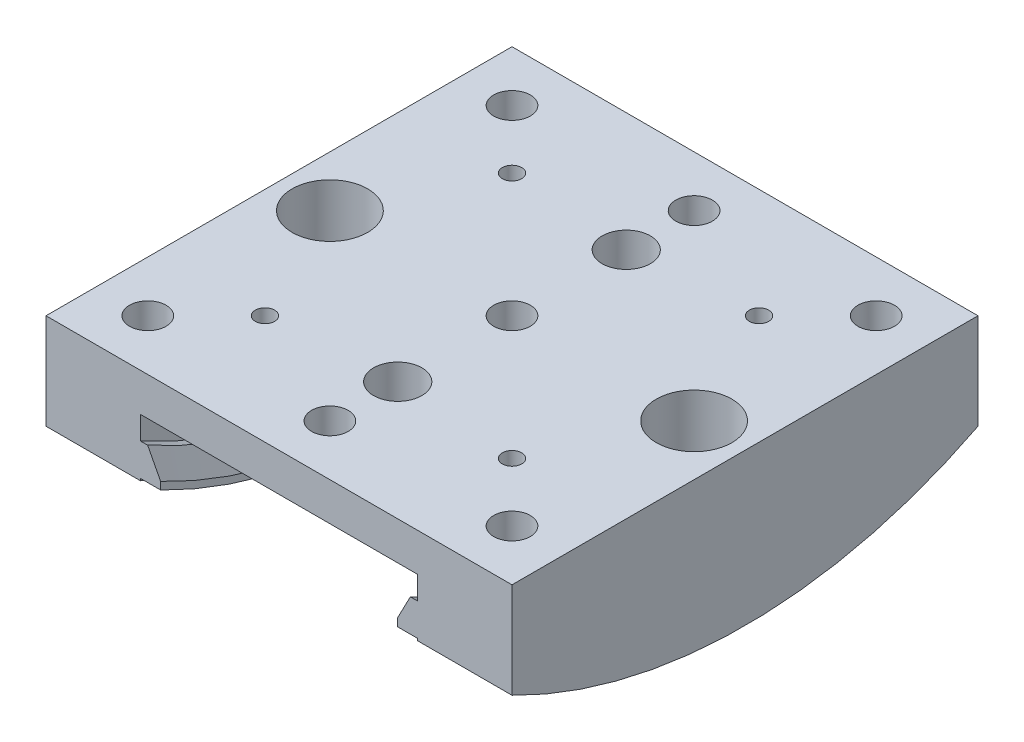
from build123d import *

# Parameters (mm, degrees)
SKIZZE1_W                            = 65
SKIZZE1_H                            = 30
AUFSATZ_LINEAR_AUSTRAGEN1_DEPTH      = 65
SCHNITT_LINEAR_AUSTRAGEN2_DEPTH      = 94.139680207
SCHNITT_LINEAR_AUSTRAGEN2_DEPTH_BACK = 94.139680207
SCHNITT_LINEAR_AUSTRAGEN4_REACH      = 77.701
SKIZZE10_R                           = 5.2705
SKIZZE10_R_2                         = 3.3655
SKIZZE10_R_3                         = 2.5525
SKIZZE10_R_4                         = 1.3525


with BuildPart() as part:
    # Skizze1 → Aufsatz-Linear austragen1 (new body)
    with BuildSketch(Plane.XY):
        Rectangle(SKIZZE1_W, SKIZZE1_H)
    extrude(amount=AUFSATZ_LINEAR_AUSTRAGEN1_DEPTH)

    # Schnitt-Austragung2: sweep along a path in Skizze8
    with BuildLine(Plane(origin=(0, 0, 0), x_dir=(0, 0, -1), z_dir=(1, 0, 0))) as schnitt_austragung2_path:
        CenterArc((-32.5, 65), 71.1987, 0, 360)
    # Skizze7 → Schnitt-Austragung2 (sweep, cut)
    with BuildSketch(Plane.XY.offset(65)):
        Polygon((19.32985, 9.6751), (-19.32985, 9.6751), (-19.32985, 6.4564), (-18.32085, 6.4564), (-16.50885, 2.9847), (-16.50885, 1.9417), (-19.32985, 1.9417), (-19.32985, 1.6517), (19.32985, 1.6517), (19.32985, 1.9417), (16.50885, 1.9417), (16.50885, 2.9847), (18.32085, 6.4564), (19.32985, 6.4564), align=None)
    sweep(path=schnitt_austragung2_path.line, mode=Mode.SUBTRACT)

    # Skizze9 → Schnitt-Linear austragen2 (cut, two sides: drawn at the far end of the back side and taken through both)
    with BuildSketch(Plane.ZY.offset(32.5).offset(-SCHNITT_LINEAR_AUSTRAGEN2_DEPTH_BACK)):
        with BuildLine():
            ThreePointArc((65, 1.651717611), (32.5, -6.1987), (0, 1.651717611))
            Line((0, 1.651717611), (0, -15))
            Line((0, -15), (65, -15))
            Line((65, -15), (65, 1.651717611))
        make_face()
    extrude(amount=SCHNITT_LINEAR_AUSTRAGEN2_DEPTH + SCHNITT_LINEAR_AUSTRAGEN2_DEPTH_BACK, mode=Mode.SUBTRACT)

    # Skizze10 → Schnitt-Linear austragen4 (cut, up to next)
    with BuildSketch(Plane(origin=(0, 15, 0), x_dir=(1, 0, 0), z_dir=(0, 1, 0)), mode=Mode.PRIVATE) as schnitt_linear_austragen4_sk1:
        with Locations(Location((-25.399, -32.5, 0), (0, 0, 270))):
            Circle(SKIZZE10_R)
    schnitt_linear_austragen4_tool1 = extrude(schnitt_linear_austragen4_sk1.sketch, amount=-SCHNITT_LINEAR_AUSTRAGEN4_REACH, mode=Mode.PRIVATE) & part.part
    # Skizze10 → Schnitt-Linear austragen4 (cut, up to next)
    with BuildSketch(Plane(origin=(0, 15, 0), x_dir=(1, 0, 0), z_dir=(0, 1, 0)), mode=Mode.PRIVATE) as schnitt_linear_austragen4_sk2:
        with Locations(Location((25.399, -32.5, 0), (0, 0, 270))):
            Circle(SKIZZE10_R)
    schnitt_linear_austragen4_tool2 = extrude(schnitt_linear_austragen4_sk2.sketch, amount=-SCHNITT_LINEAR_AUSTRAGEN4_REACH, mode=Mode.PRIVATE) & part.part
    # Skizze10 → Schnitt-Linear austragen4 (cut, up to next)
    with BuildSketch(Plane(origin=(0, 15, 0), x_dir=(1, 0, 0), z_dir=(0, 1, 0)), mode=Mode.PRIVATE) as schnitt_linear_austragen4_sk3:
        with Locations(Location((0, -16.562, 0), (0, 0, 270))):
            Circle(SKIZZE10_R_2)
    schnitt_linear_austragen4_tool3 = extrude(schnitt_linear_austragen4_sk3.sketch, amount=-SCHNITT_LINEAR_AUSTRAGEN4_REACH, mode=Mode.PRIVATE) & part.part
    # Skizze10 → Schnitt-Linear austragen4 (cut, up to next)
    with BuildSketch(Plane(origin=(0, 15, 0), x_dir=(1, 0, 0), z_dir=(0, 1, 0)), mode=Mode.PRIVATE) as schnitt_linear_austragen4_sk4:
        with Locations(Location((0, -48.438, 0), (0, 0, 270))):
            Circle(SKIZZE10_R_2)
    schnitt_linear_austragen4_tool4 = extrude(schnitt_linear_austragen4_sk4.sketch, amount=-SCHNITT_LINEAR_AUSTRAGEN4_REACH, mode=Mode.PRIVATE) & part.part
    # Skizze10 → Schnitt-Linear austragen4 (cut, up to next)
    with BuildSketch(Plane(origin=(0, 15, 0), x_dir=(1, 0, 0), z_dir=(0, 1, 0)), mode=Mode.PRIVATE) as schnitt_linear_austragen4_sk5:
        with Locations(Location((-25.4, -7.1, 0), (0, 0, 270))):
            Circle(SKIZZE10_R_3)
    schnitt_linear_austragen4_tool5 = extrude(schnitt_linear_austragen4_sk5.sketch, amount=-SCHNITT_LINEAR_AUSTRAGEN4_REACH, mode=Mode.PRIVATE) & part.part
    # Skizze10 → Schnitt-Linear austragen4 (cut, up to next)
    with BuildSketch(Plane(origin=(0, 15, 0), x_dir=(1, 0, 0), z_dir=(0, 1, 0)), mode=Mode.PRIVATE) as schnitt_linear_austragen4_sk6:
        with Locations(Location((25.4, -7.1, 0), (0, 0, 270))):
            Circle(SKIZZE10_R_3)
    schnitt_linear_austragen4_tool6 = extrude(schnitt_linear_austragen4_sk6.sketch, amount=-SCHNITT_LINEAR_AUSTRAGEN4_REACH, mode=Mode.PRIVATE) & part.part
    # Skizze10 → Schnitt-Linear austragen4 (cut, up to next)
    with BuildSketch(Plane(origin=(0, 15, 0), x_dir=(1, 0, 0), z_dir=(0, 1, 0)), mode=Mode.PRIVATE) as schnitt_linear_austragen4_sk7:
        with Locations(Location((0, -7.1, 0), (0, 0, 270))):
            Circle(SKIZZE10_R_3)
    schnitt_linear_austragen4_tool7 = extrude(schnitt_linear_austragen4_sk7.sketch, amount=-SCHNITT_LINEAR_AUSTRAGEN4_REACH, mode=Mode.PRIVATE) & part.part
    # Skizze10 → Schnitt-Linear austragen4 (cut, up to next)
    with BuildSketch(Plane(origin=(0, 15, 0), x_dir=(1, 0, 0), z_dir=(0, 1, 0)), mode=Mode.PRIVATE) as schnitt_linear_austragen4_sk8:
        with Locations(Location((25.4, -57.9, 0), (0, 0, 270))):
            Circle(SKIZZE10_R_3)
    schnitt_linear_austragen4_tool8 = extrude(schnitt_linear_austragen4_sk8.sketch, amount=-SCHNITT_LINEAR_AUSTRAGEN4_REACH, mode=Mode.PRIVATE) & part.part
    # Skizze10 → Schnitt-Linear austragen4 (cut, up to next)
    with BuildSketch(Plane(origin=(0, 15, 0), x_dir=(1, 0, 0), z_dir=(0, 1, 0)), mode=Mode.PRIVATE) as schnitt_linear_austragen4_sk9:
        with Locations(Location((0, -57.9, 0), (0, 0, 270))):
            Circle(SKIZZE10_R_3)
    schnitt_linear_austragen4_tool9 = extrude(schnitt_linear_austragen4_sk9.sketch, amount=-SCHNITT_LINEAR_AUSTRAGEN4_REACH, mode=Mode.PRIVATE) & part.part
    # Skizze10 → Schnitt-Linear austragen4 (cut, up to next)
    with BuildSketch(Plane(origin=(0, 15, 0), x_dir=(1, 0, 0), z_dir=(0, 1, 0)), mode=Mode.PRIVATE) as schnitt_linear_austragen4_sk10:
        with Locations(Location((-25.4, -57.9, 0), (0, 0, 270))):
            Circle(SKIZZE10_R_3)
    schnitt_linear_austragen4_tool10 = extrude(schnitt_linear_austragen4_sk10.sketch, amount=-SCHNITT_LINEAR_AUSTRAGEN4_REACH, mode=Mode.PRIVATE) & part.part
    # Skizze10 → Schnitt-Linear austragen4 (cut, up to next)
    with BuildSketch(Plane(origin=(0, 15, 0), x_dir=(1, 0, 0), z_dir=(0, 1, 0)), mode=Mode.PRIVATE) as schnitt_linear_austragen4_sk11:
        with Locations(Location((-17.227, -15.273, 0), (0, 0, 270))):
            Circle(SKIZZE10_R_4)
    schnitt_linear_austragen4_tool11 = extrude(schnitt_linear_austragen4_sk11.sketch, amount=-SCHNITT_LINEAR_AUSTRAGEN4_REACH, mode=Mode.PRIVATE) & part.part
    # Skizze10 → Schnitt-Linear austragen4 (cut, up to next)
    with BuildSketch(Plane(origin=(0, 15, 0), x_dir=(1, 0, 0), z_dir=(0, 1, 0)), mode=Mode.PRIVATE) as schnitt_linear_austragen4_sk12:
        with Locations(Location((17.227, -15.273, 0), (0, 0, 270))):
            Circle(SKIZZE10_R_4)
    schnitt_linear_austragen4_tool12 = extrude(schnitt_linear_austragen4_sk12.sketch, amount=-SCHNITT_LINEAR_AUSTRAGEN4_REACH, mode=Mode.PRIVATE) & part.part
    # Skizze10 → Schnitt-Linear austragen4 (cut, up to next)
    with BuildSketch(Plane(origin=(0, 15, 0), x_dir=(1, 0, 0), z_dir=(0, 1, 0)), mode=Mode.PRIVATE) as schnitt_linear_austragen4_sk13:
        with Locations(Location((17.227, -49.727, 0), (0, 0, 270))):
            Circle(SKIZZE10_R_4)
    schnitt_linear_austragen4_tool13 = extrude(schnitt_linear_austragen4_sk13.sketch, amount=-SCHNITT_LINEAR_AUSTRAGEN4_REACH, mode=Mode.PRIVATE) & part.part
    # Skizze10 → Schnitt-Linear austragen4 (cut, up to next)
    with BuildSketch(Plane(origin=(0, 15, 0), x_dir=(1, 0, 0), z_dir=(0, 1, 0)), mode=Mode.PRIVATE) as schnitt_linear_austragen4_sk14:
        with Locations(Location((-17.227, -49.727, 0), (0, 0, 270))):
            Circle(SKIZZE10_R_4)
    schnitt_linear_austragen4_tool14 = extrude(schnitt_linear_austragen4_sk14.sketch, amount=-SCHNITT_LINEAR_AUSTRAGEN4_REACH, mode=Mode.PRIVATE) & part.part
    # Skizze10 → Schnitt-Linear austragen4 (cut, up to next)
    with BuildSketch(Plane(origin=(0, 15, 0), x_dir=(1, 0, 0), z_dir=(0, 1, 0)), mode=Mode.PRIVATE) as schnitt_linear_austragen4_sk15:
        with Locations(Location((0, -32.5, 0), (0, 0, 270))):
            Circle(SKIZZE10_R_3)
    schnitt_linear_austragen4_tool15 = extrude(schnitt_linear_austragen4_sk15.sketch, amount=-SCHNITT_LINEAR_AUSTRAGEN4_REACH, mode=Mode.PRIVATE) & part.part
    add(schnitt_linear_austragen4_tool1.solids().sort_by_distance((-25.399, 15, 32.5))[0], mode=Mode.SUBTRACT)
    add(schnitt_linear_austragen4_tool2.solids().sort_by_distance((25.399, 15, 32.5))[0], mode=Mode.SUBTRACT)
    add(schnitt_linear_austragen4_tool3.solids().sort_by_distance((0, 15, 16.562))[0], mode=Mode.SUBTRACT)
    add(schnitt_linear_austragen4_tool4.solids().sort_by_distance((0, 15, 48.438))[0], mode=Mode.SUBTRACT)
    add(schnitt_linear_austragen4_tool5.solids().sort_by_distance((-25.4, 15, 7.1))[0], mode=Mode.SUBTRACT)
    add(schnitt_linear_austragen4_tool6.solids().sort_by_distance((25.4, 15, 7.1))[0], mode=Mode.SUBTRACT)
    add(schnitt_linear_austragen4_tool7.solids().sort_by_distance((0, 15, 7.1))[0], mode=Mode.SUBTRACT)
    add(schnitt_linear_austragen4_tool8.solids().sort_by_distance((25.4, 15, 57.9))[0], mode=Mode.SUBTRACT)
    add(schnitt_linear_austragen4_tool9.solids().sort_by_distance((0, 15, 57.9))[0], mode=Mode.SUBTRACT)
    add(schnitt_linear_austragen4_tool10.solids().sort_by_distance((-25.4, 15, 57.9))[0], mode=Mode.SUBTRACT)
    add(schnitt_linear_austragen4_tool11.solids().sort_by_distance((-17.227, 15, 15.273))[0], mode=Mode.SUBTRACT)
    add(schnitt_linear_austragen4_tool12.solids().sort_by_distance((17.227, 15, 15.273))[0], mode=Mode.SUBTRACT)
    add(schnitt_linear_austragen4_tool13.solids().sort_by_distance((17.227, 15, 49.727))[0], mode=Mode.SUBTRACT)
    add(schnitt_linear_austragen4_tool14.solids().sort_by_distance((-17.227, 15, 49.727))[0], mode=Mode.SUBTRACT)
    add(schnitt_linear_austragen4_tool15.solids().sort_by_distance((0, 15, 32.5))[0], mode=Mode.SUBTRACT)


solid = part.part
